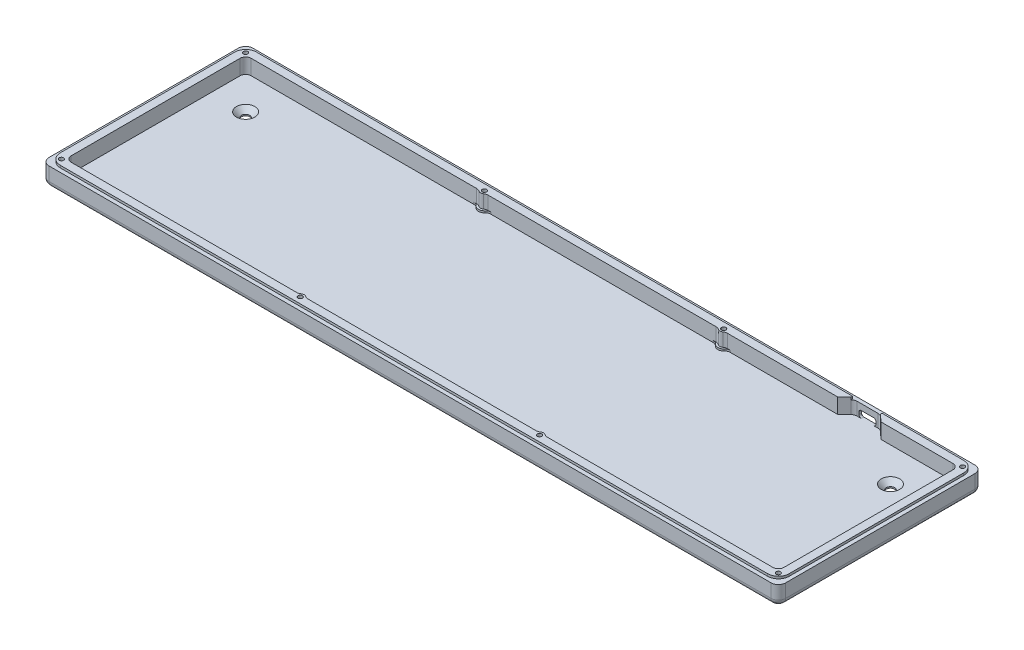
from build123d import *

# Parameters (mm, degrees)
SKETCH1_W                                      = 401
SKETCH1_H                                      = 111
BOSS_EXTRUDE1_DEPTH                            = 13.5
SKETCH2_W                                      = 401
SKETCH2_H                                      = 111
SKETCH2_W_2                                    = 397
SKETCH2_H_2                                    = 107
CUT_EXTRUDE1_DEPTH                             = 1.5
FILLET1_R                                      = 6
FILLET2_R                                      = 4
CUT_EXTRUDE2_DEPTH                             = 8.5
SKETCH4_W                                      = 425.758885171
SKETCH4_H                                      = 132.096565748
CUT_EXTRUDE3_DEPTH                             = 1.5
CUT_EXTRUDE4_DEPTH                             = 8.5
CUT_EXTRUDE5_DEPTH                             = 8.5
FILLET3_R                                      = 3.175
CUT_EXTRUDE6_DEPTH                             = 0.375
CHAMFER1_SIZE                                  = 0.254
CUT_EXTRUDE7_DEPTH                             = 5
CUT_EXTRUDE7_DEPTH_BACK                        = 5
SKETCH8_W                                      = 16.017090682
SKETCH8_H                                      = 1.5
SKETCH9_R                                      = 37.5
CUT_EXTRUDE8_DEPTH                             = 10
BOSS_EXTRUDE4_DEPTH                            = 1
FILLET4_R                                      = 3.175
BOSS_EXTRUDE5_DEPTH                            = 7.5
CBORE_FOR_M2_SHCS2_D                           = 2.4
CBORE_FOR_M2_SHCS2_CBORE_D                     = 4.4
CBORE_FOR_M2_SHCS2_CBORE_DEPTH                 = 2.3
SKETCH33_W                                     = 427.456701586
SKETCH33_H                                     = 134.15369465
CUT_EXTRUDE9_DEPTH                             = 0.25
SKETCH37_R                                     = 45
BOSS_EXTRUDE6_DEPTH                            = 1.1
CSK_FOR_M4_FLAT_HEAD_MACHINE_SCREW1_AT_2_COUNT = 2
CSK_FOR_M4_FLAT_HEAD_MACHINE_SCREW1_AT_2_PITCH = 351
FILLET5_R                                      = 3.175
SKETCH40_W                                     = 472.271796357
SKETCH40_H                                     = 174.060638188
CUT_EXTRUDE10_DEPTH                            = 1.25


with BuildPart() as part:
    # Sketch1 → Boss-Extrude1 (new body)
    with BuildSketch(Plane(origin=(0, 0, 0), x_dir=(1, 0, 0), z_dir=(0, 1, 0))):
        with Locations((-200.5, 55.5)):
            Rectangle(SKETCH1_W, SKETCH1_H)
    extrude(amount=BOSS_EXTRUDE1_DEPTH)

    # Sketch2 → Cut-Extrude1 (cut)
    with BuildSketch(Plane(origin=(0, 13.5, 0), x_dir=(1, 0, 0), z_dir=(0, 1, 0))):
        with Locations((-200.5, 55.5)):
            Rectangle(SKETCH2_W, SKETCH2_H)
        with Locations((-200.5, 55.5)):
            Rectangle(SKETCH2_W_2, SKETCH2_H_2, mode=Mode.SUBTRACT)
    extrude(amount=-CUT_EXTRUDE1_DEPTH, mode=Mode.SUBTRACT)

    # Fillet1
    fillet1_edges = [part.edges().sort_by_distance(p)[0] for p in [
        (-2, 12.75, -2),
        (-399, 12.75, -2),
        (-399, 12.75, -109),
        (-2, 12.75, -109),
    ]]
    fillet(fillet1_edges, radius=FILLET1_R)

    # Fillet2
    fillet2_edges = [part.edges().sort_by_distance(p)[0] for p in [
        (0, 6, 0),
        (-401, 6, 0),
        (-401, 6, -111),
        (0, 6, -111),
    ]]
    fillet(fillet2_edges, radius=FILLET2_R)

    # Sketch3 → Cut-Extrude2 (cut)
    with BuildSketch(Plane(origin=(0, 13.5, 0), x_dir=(1, 0, 0), z_dir=(0, 1, 0))):
        with BuildLine():
            Line((-9.5, 6.5), (-391.5, 6.5))
            ThreePointArc((-391.5, 6.5), (-393.621320344, 7.378679656), (-394.5, 9.5))
            Line((-394.5, 9.5), (-394.5, 101.5))
            ThreePointArc((-394.5, 101.5), (-393.621320344, 103.621320344), (-391.5, 104.5))
            Line((-391.5, 104.5), (-9.5, 104.5))
            ThreePointArc((-9.5, 104.5), (-7.378679656, 103.621320344), (-6.5, 101.5))
            Line((-6.5, 101.5), (-6.5, 9.5))
            ThreePointArc((-6.5, 9.5), (-7.378679656, 7.378679656), (-9.5, 6.5))
        make_face()
    extrude(amount=-CUT_EXTRUDE2_DEPTH, mode=Mode.SUBTRACT)

    # Sketch4 → Cut-Extrude3 (cut)
    with BuildSketch(Plane.XZ):
        with Locations((-205.400573141, -53.58073678)):
            Rectangle(SKETCH4_W, SKETCH4_H)
    extrude(amount=-CUT_EXTRUDE3_DEPTH, mode=Mode.SUBTRACT)

    # Sketch5 → Cut-Extrude4 (cut)
    with BuildSketch(Plane(origin=(0, 13.5, 0), x_dir=(1, 0, 0), z_dir=(0, 1, 0))):
        with BuildLine():
            Line((-73.3928, 103.5), (-68.508545341, 108.058681888))
            ThreePointArc((-68.508545341, 108.058681888), (-67.403893551, 108.756177714), (-66.120419088, 109))
            Line((-66.120419088, 109), (-54.879580912, 109))
            ThreePointArc((-54.879580912, 109), (-53.596106449, 108.756177714), (-52.491454659, 108.058681888))
            Line((-52.491454659, 108.058681888), (-47.6072, 103.5))
            Line((-47.6072, 103.5), (-73.3928, 103.5))
        make_face()
    extrude(amount=-CUT_EXTRUDE4_DEPTH, mode=Mode.SUBTRACT)

    # Sketch6 → Cut-Extrude5 (cut)
    with BuildSketch(Plane.XY.offset(-109)):
        with BuildLine():
            Line((-63.900019088, 8.75), (-57.100019088, 8.75))
            ThreePointArc((-57.100019088, 8.75), (-56.216135611, 8.383883476), (-55.850019088, 7.5))
            Line((-55.850019088, 7.5), (-55.850019088, 6.25))
            ThreePointArc((-55.850019088, 6.25), (-56.216135611, 5.366116524), (-57.100019088, 5))
            Line((-57.100019088, 5), (-63.900019088, 5))
            ThreePointArc((-63.900019088, 5), (-64.783902564, 5.366116524), (-65.150019088, 6.25))
            Line((-65.150019088, 6.25), (-65.150019088, 7.5))
            ThreePointArc((-65.150019088, 7.5), (-64.783902564, 8.383883476), (-63.900019088, 8.75))
        make_face()
    extrude(amount=-CUT_EXTRUDE5_DEPTH, mode=Mode.SUBTRACT)

    # Fillet3
    fillet3_edges = [part.edges().sort_by_distance(p)[0] for p in [
        (-1.171572875, 1.5, -109.828427125),
        (-401, 1.5, -55.5),
        (-200.5, 1.5, -111),
        (0, 1.5, -55.5),
        (-200.5, 1.5, 0),
        (-399.828427125, 1.5, -1.171572875),
        (-1.171572875, 1.5, -1.171572875),
        (-399.828427125, 1.5, -109.828427125),
    ]]
    fillet(fillet3_edges, radius=FILLET3_R)

    # Sketch7 → Cut-Extrude6 (cut)
    with BuildSketch(Plane(origin=(0, 0, -111), x_dir=(-1, 0, 0), z_dir=(0, 0, -1))):
        with BuildLine():
            Line((56.675019088, 11.125), (64.325019088, 11.125))
            ThreePointArc((64.325019088, 11.125), (66.570083118, 10.19506403), (67.500019088, 7.95))
            Line((67.500019088, 7.95), (67.500019088, 1.125))
            Line((67.500019088, 1.125), (53.500019088, 1.125))
            Line((53.500019088, 1.125), (53.500019088, 7.95))
            ThreePointArc((53.500019088, 7.95), (54.429955058, 10.19506403), (56.675019088, 11.125))
        make_face()
    extrude(amount=-CUT_EXTRUDE6_DEPTH, mode=Mode.SUBTRACT)

    # Chamfer1
    chamfer1_edges = [part.edges().sort_by_distance(p)[0] for p in [
        (-56.216135611, 5.366116524, -110.625),
        (-55.850019088, 6.875, -110.625),
        (-56.216135611, 8.383883476, -110.625),
        (-60.500019088, 8.75, -110.625),
        (-64.783902564, 8.383883476, -110.625),
        (-65.150019088, 6.875, -110.625),
        (-64.783902564, 5.366116524, -110.625),
        (-60.500019088, 5, -110.625),
    ]]
    chamfer(chamfer1_edges, length=CHAMFER1_SIZE)

    # Sketch8 → Cut-Extrude7 (cut, two sides: drawn at the far end of the back side and taken through both)
    with BuildSketch(Plane(origin=(0, 0, -109), x_dir=(-1, 0, 0), z_dir=(0, 0, -1)).offset(-CUT_EXTRUDE7_DEPTH_BACK)):
        with Locations((60.5, 12.75)):
            Rectangle(SKETCH8_W, SKETCH8_H)
    extrude(amount=CUT_EXTRUDE7_DEPTH + CUT_EXTRUDE7_DEPTH_BACK, mode=Mode.SUBTRACT)

    # Sketch9 → Cut-Extrude8 (cut)
    with BuildSketch(Plane.XZ.offset(-1.5)):
        with Locations(Location((-200.5, -55.5, 0), (0, 0, 270))):
            Circle(SKETCH9_R)
    extrude(amount=-CUT_EXTRUDE8_DEPTH, mode=Mode.SUBTRACT)

    # Sketch25 → Boss-Extrude4 (add)
    with BuildSketch(Plane(origin=(0, 5, 0), x_dir=(1, 0, 0), z_dir=(0, 1, 0))):
        with BuildLine():
            Line((-138.370726122, 104.5), (-132.379273878, 104.5))
            ThreePointArc((-132.379273878, 104.5), (-135.375, 102.425), (-138.370726122, 104.5))
        make_face()
        with BuildLine():
            Line((-268.620726122, 104.5), (-262.629273878, 104.5))
            ThreePointArc((-262.629273878, 104.5), (-265.625, 102.425), (-268.620726122, 104.5))
        make_face()
        with BuildLine():
            Line((-138.370726122, 6.5), (-132.379273878, 6.5))
            ThreePointArc((-132.379273878, 6.5), (-135.375, 8.575), (-138.370726122, 6.5))
        make_face()
        with BuildLine():
            Line((-268.620726122, 6.5), (-262.629273878, 6.5))
            ThreePointArc((-262.629273878, 6.5), (-265.625, 8.575), (-268.620726122, 6.5))
        make_face()
    extrude(amount=BOSS_EXTRUDE4_DEPTH)

    # Fillet4
    fillet4_edges = [part.edges().sort_by_distance(p)[0] for p in [
        (-268.620726122, 5.5, -104.5),
        (-262.629273878, 5.5, -104.5),
        (-138.370726122, 5.5, -104.5),
        (-132.379273878, 5.5, -104.5),
        (-132.379273878, 5.5, -6.5),
        (-138.370726122, 5.5, -6.5),
        (-262.629273878, 5.5, -6.5),
        (-268.620726122, 5.5, -6.5),
    ]]
    fillet(fillet4_edges, radius=FILLET4_R)

    # Sketch27 → Boss-Extrude5 (add)
    with BuildSketch(Plane(origin=(0, 6, 0), x_dir=(1, 0, 0), z_dir=(0, 1, 0))):
        with BuildLine():
            Line((-267.427775638, 104.5), (-263.822224362, 104.5))
            ThreePointArc((-263.822224362, 104.5), (-265.625, 103.5), (-267.427775638, 104.5))
        make_face()
        with BuildLine():
            Line((-137.177775638, 104.5), (-133.572224362, 104.5))
            ThreePointArc((-133.572224362, 104.5), (-135.375, 103.5), (-137.177775638, 104.5))
        make_face()
        with BuildLine():
            Line((-137.177775638, 6.5), (-133.572224362, 6.5))
            ThreePointArc((-133.572224362, 6.5), (-135.375, 7.5), (-137.177775638, 6.5))
        make_face()
        with BuildLine():
            Line((-267.427775638, 6.5), (-263.822224362, 6.5))
            ThreePointArc((-263.822224362, 6.5), (-265.625, 7.5), (-267.427775638, 6.5))
        make_face()
    extrude(amount=BOSS_EXTRUDE5_DEPTH)

    # CBORE for M2 SHCS2 (through all)
    with Locations(Plane(origin=(-5.375, 1.5, -105.625), x_dir=(0, 0, -1), z_dir=(0, -1, 0))):
        with Locations((0, 0), (0, -130), (0, -260.25), (0, -390.25), (-100.25, -390.25), (-100.25, -260.25), (-100.25, -130), (-100.25, 0)):
            CounterBoreHole(CBORE_FOR_M2_SHCS2_D / 2, CBORE_FOR_M2_SHCS2_CBORE_D / 2, CBORE_FOR_M2_SHCS2_CBORE_DEPTH)

    # Sketch33 → Cut-Extrude9 (cut)
    with BuildSketch(Plane(origin=(0, 13.5, 0), x_dir=(1, 0, 0), z_dir=(0, 1, 0))):
        with Locations((-199.55079933, 53.126998326)):
            Rectangle(SKETCH33_W, SKETCH33_H)
    extrude(amount=-CUT_EXTRUDE9_DEPTH, mode=Mode.SUBTRACT)

    # Sketch37 → Boss-Extrude6 (add)
    with BuildSketch(Plane(origin=(0, 5, 0), x_dir=(1, 0, 0), z_dir=(0, 1, 0))):
        with Locations((-200.5, 55.5)):
            Circle(SKETCH37_R)
    extrude(amount=-BOSS_EXTRUDE6_DEPTH)

    # Sketch38 → CSK for M4 Flat Head Machine Screw1 (revolve, cut)
    with BuildSketch(Plane(origin=(-376, 5, -86), x_dir=(0, 0, 1), z_dir=(1, 0, 0))):
        Polygon((0, 0), (0, 3.5), (2.25, 3.5), (2.25, 2.75), (5, 0), align=None)
    csk_for_m4_flat_head_machine_screw1 = revolve(axis=Axis((-376, 11.35, -86), (0, -1, 0)), mode=Mode.SUBTRACT)

    # CSK for M4 Flat Head Machine Screw1 at 2: CSK for M4 Flat Head Machine Screw1 ×2
    with Locations(*[(i * CSK_FOR_M4_FLAT_HEAD_MACHINE_SCREW1_AT_2_PITCH, 0, 0) for i in range(1, CSK_FOR_M4_FLAT_HEAD_MACHINE_SCREW1_AT_2_COUNT)]):
        add(csk_for_m4_flat_head_machine_screw1, mode=Mode.SUBTRACT)

    # Fillet5
    fillet5_edges = [part.edges().sort_by_distance(p)[0] for p in [
        (-263.822224362, 9.625, -6.5),
        (-267.427775638, 9.625, -6.5),
        (-133.572224362, 9.625, -6.5),
        (-137.177775638, 9.625, -6.5),
        (-137.177775638, 9.625, -104.5),
        (-133.572224362, 9.625, -104.5),
        (-267.427775638, 9.625, -104.5),
        (-263.822224362, 9.625, -104.5),
    ]]
    fillet(fillet5_edges, radius=FILLET5_R)

    # Sketch40 → Cut-Extrude10 (cut)
    with BuildSketch(Plane(origin=(0, 13.25, 0), x_dir=(1, 0, 0), z_dir=(0, 1, 0))):
        with Locations((-179.677600421, 43.410464589)):
            Rectangle(SKETCH40_W, SKETCH40_H)
        with BuildLine():
            Line((-52.491454659, 108.875), (-8, 108.875))
            ThreePointArc((-8, 108.875), (-3.845747661, 107.154252339), (-2.125, 103))
            Line((-2.125, 103), (-2.125, 8))
            ThreePointArc((-2.125, 8), (-3.845747661, 3.845747661), (-8, 2.125))
            Line((-8, 2.125), (-393, 2.125))
            ThreePointArc((-393, 2.125), (-397.154252339, 3.845747661), (-398.875, 8))
            Line((-398.875, 8), (-398.875, 103))
            ThreePointArc((-398.875, 103), (-397.154252339, 107.154252339), (-393, 108.875))
            Line((-393, 108.875), (-52.491454659, 108.875))
        make_face(mode=Mode.SUBTRACT)
    extrude(amount=-CUT_EXTRUDE10_DEPTH, mode=Mode.SUBTRACT)


solid = part.part
